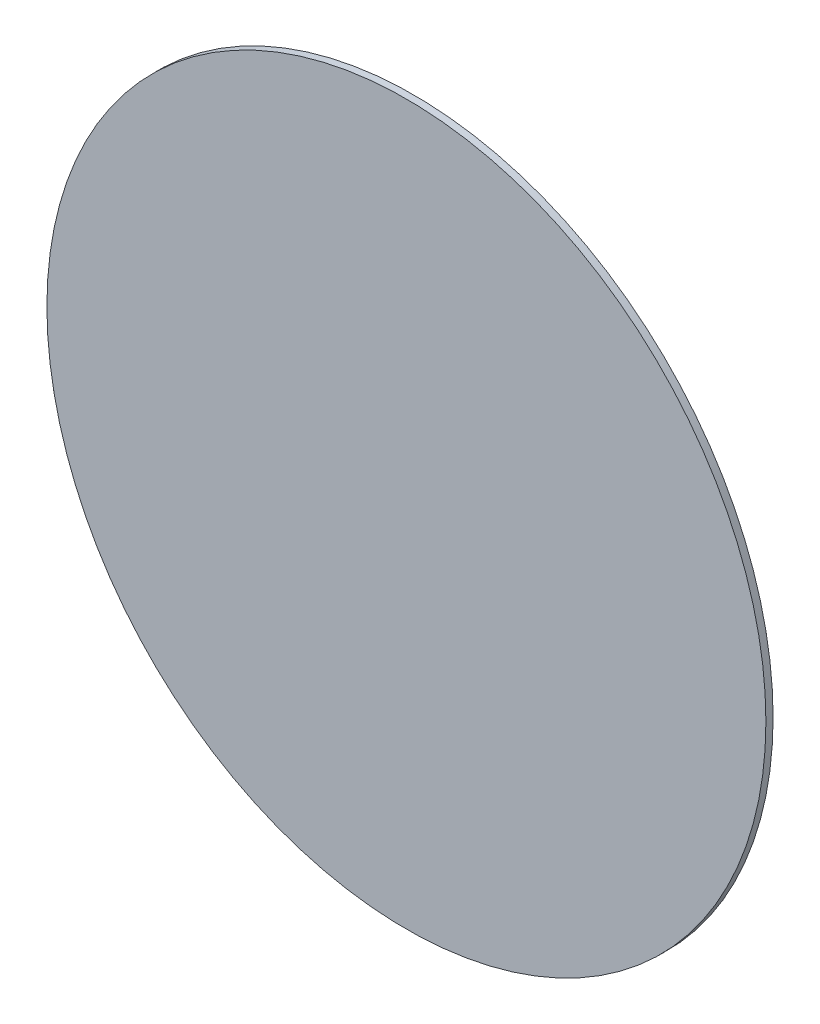
from build123d import *

# Parameters (mm, degrees)
SKETCH1_R      = 25
EXTRUDE1_DEPTH = 0.5


with BuildPart() as part:
    # Sketch1 → Extrude1 (new body)
    with BuildSketch(Plane.XY):
        Circle(SKETCH1_R)
    extrude(amount=EXTRUDE1_DEPTH)


solid = part.part
